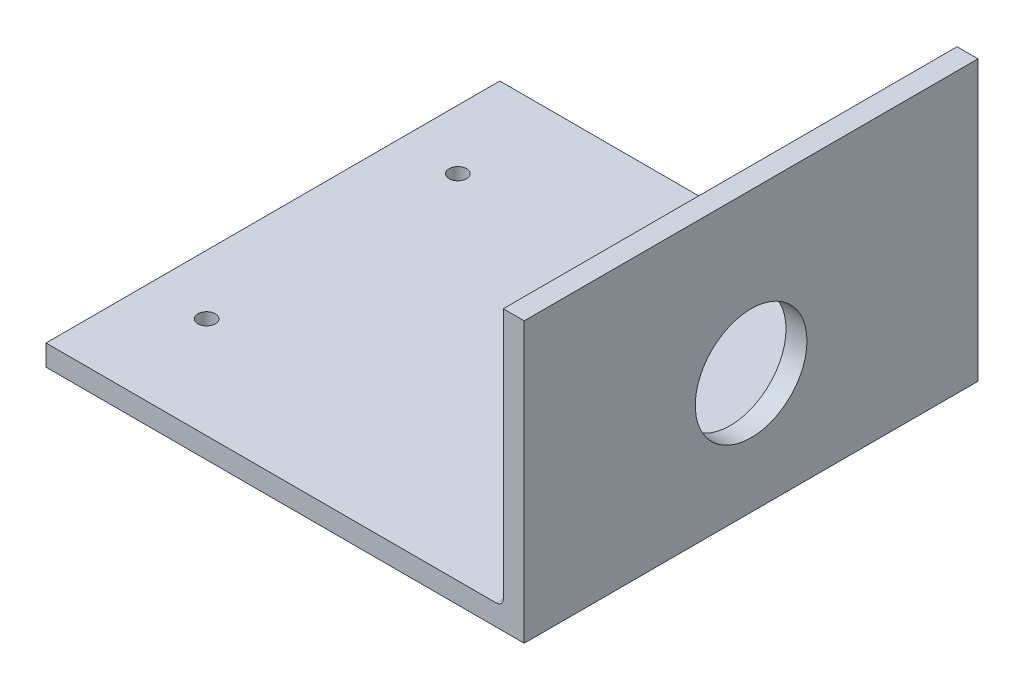
from build123d import *

# Parameters (mm, degrees)
SKETCH3_W           = 65
SKETCH3_H           = 65
BOSS_EXTRUDE2_DEPTH = 3
BOSS_EXTRUDE3_DEPTH = 65
CUT_EXTRUDE1_REACH  = 1619.511
SKETCH6_R           = 8
FILLET1_R           = 1


with BuildPart() as part:
    # Sketch3 → Boss-Extrude2 (new body)
    with BuildSketch(Plane.XZ.offset(-863.629465365)):
        with Locations((685.231990878, 1309.332866284)):
            Rectangle(SKETCH3_W, SKETCH3_H)
        with BuildLine():
            ThreePointArc((659.981990878, 1327.332866288), (660.3481074, 1326.448982809), (661.231990878, 1326.082866284))
            ThreePointArc((661.231990878, 1326.082866284), (662.115874352, 1326.448982806), (662.481990878, 1327.332866278))
            ThreePointArc((662.481990878, 1327.332866278), (662.115874357, 1328.216749759), (661.231990878, 1328.582866284))
            ThreePointArc((661.231990878, 1328.582866284), (660.348107403, 1328.216749762), (659.981990878, 1327.332866288))
        make_face(mode=Mode.SUBTRACT)
        with BuildLine():
            ThreePointArc((659.981990878, 1291.332866288), (660.3481074, 1290.448982809), (661.231990878, 1290.082866284))
            ThreePointArc((661.231990878, 1290.082866284), (662.115874352, 1290.448982806), (662.481990878, 1291.332866278))
            ThreePointArc((662.481990878, 1291.332866278), (662.115874357, 1292.216749759), (661.231990878, 1292.582866284))
            ThreePointArc((661.231990878, 1292.582866284), (660.348107403, 1292.216749762), (659.981990878, 1291.332866288))
        make_face(mode=Mode.SUBTRACT)
        with BuildLine():
            ThreePointArc((707.981990878, 1291.332866288), (708.3481074, 1290.448982809), (709.231990878, 1290.082866284))
            ThreePointArc((709.231990878, 1290.082866284), (710.115874352, 1290.448982806), (710.481990878, 1291.332866278))
            ThreePointArc((710.481990878, 1291.332866278), (710.115874357, 1292.216749759), (709.231990878, 1292.582866284))
            ThreePointArc((709.231990878, 1292.582866284), (708.348107403, 1292.216749762), (707.981990878, 1291.332866288))
        make_face(mode=Mode.SUBTRACT)
        with BuildLine():
            ThreePointArc((707.981990878, 1327.332866284), (708.348107402, 1326.448982808), (709.231990878, 1326.082866284))
            ThreePointArc((709.231990878, 1326.082866284), (710.115874352, 1326.448982805), (710.481990878, 1327.332866277))
            ThreePointArc((710.481990878, 1327.332866277), (710.115874357, 1328.216749758), (709.231990878, 1328.582866284))
            ThreePointArc((709.231990878, 1328.582866284), (708.348107402, 1328.216749761), (707.981990878, 1327.332866284))
        make_face(mode=Mode.SUBTRACT)
    extrude(amount=BOSS_EXTRUDE2_DEPTH)

    # Sketch4 → Boss-Extrude3 (add)
    with BuildSketch(Plane(origin=(0, 0, 1276.832866284), x_dir=(-1, 0, 0), z_dir=(0, 0, -1))):
        Polygon((-717.731990878, 860.629465365), (-717.731990878, 863.629465365), (-718.231990878, 863.629465365), (-718.231990878, 900.629465365), (-721.231990878, 900.629465365), (-721.231990878, 860.629465365), align=None)
    extrude(amount=-BOSS_EXTRUDE3_DEPTH)

    # Sketch6 → Cut-Extrude1 (cut, up to next)
    with BuildSketch(Plane(origin=(721.231990878, 0, 0), x_dir=(0, 0, -1), z_dir=(1, 0, 0)), mode=Mode.PRIVATE) as cut_extrude1_sk1:
        with Locations((-1309.332866284, 877.879465365)):
            Circle(SKETCH6_R)
    cut_extrude1_tool1 = extrude(cut_extrude1_sk1.sketch, amount=-CUT_EXTRUDE1_REACH, mode=Mode.PRIVATE) & part.part
    add(cut_extrude1_tool1.solids().sort_by_distance((721.231991, 877.879465, 1309.332866))[0], mode=Mode.SUBTRACT)

    # Fillet1
    fillet1_edges = [part.edges().sort_by_distance(p)[0] for p in [
        (718.231990878, 863.629465365, 1309.332866284),
    ]]
    fillet(fillet1_edges, radius=FILLET1_R)


solid = part.part
